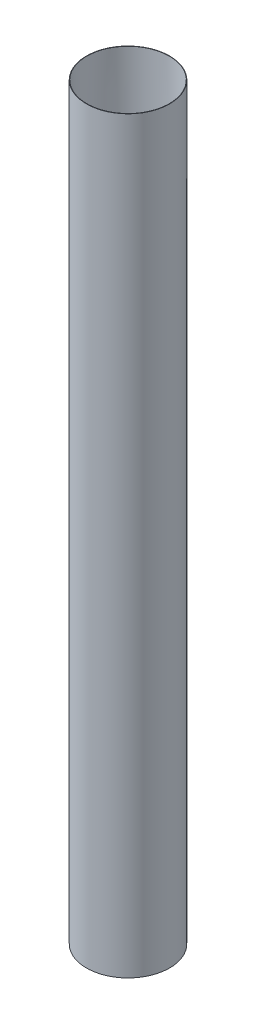
from build123d import *


with BuildPart() as part:
    # Sketch1 → Revolve1 (revolve)
    with BuildSketch(Plane.XY, mode=Mode.PRIVATE) as revolve1_sk:
        Polygon((4945, 0), (5000, 0), (5000, 90000), (4959, 90000), align=None)
    revolve(revolve1_sk.sketch.rotate(Axis((0, 0, 0), (0, 1, 0)), 90), axis=Axis((0, 0, 0), (0, 1, 0)))


solid = part.part
